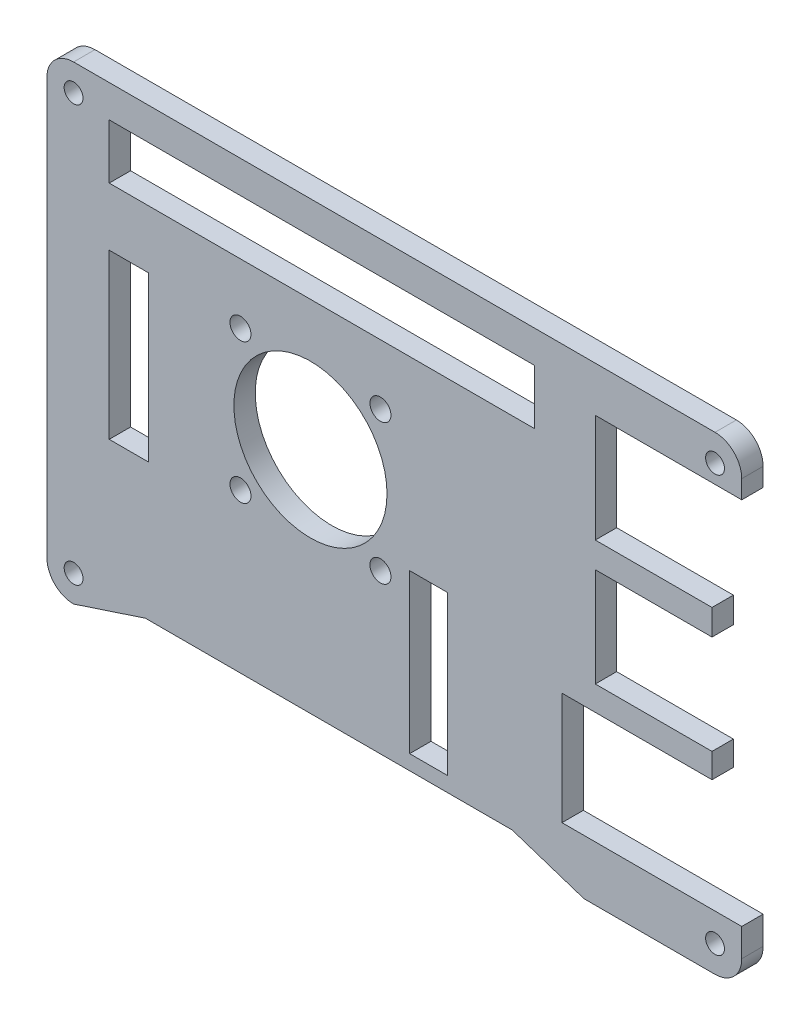
from build123d import *

# Parameters (mm, degrees)
SKETCH1_R           = 1.3462
SKETCH1_W           = 5.4034
SKETCH1_H           = 22.6066
SKETCH1_W_2         = 60.6932
SKETCH1_H_2         = 7.81
SKETCH1_W_3         = 5.588
SKETCH1_H_3         = 23.368
BOSS_EXTRUDE1_DEPTH = 3.048
SKETCH2_R           = 10.922
SKETCH2_R_2         = 1.4986
CUT_EXTRUDE1_DEPTH  = 72.310891511


with BuildPart() as part:
    # Sketch1 → Boss-Extrude1 (new body)
    with BuildSketch(Plane.XY):
        with BuildLine():
            Line((57.404932375, 30.507694304), (-34.084892625, 30.507694304))
            ThreePointArc((-34.084892625, 30.507694304), (-36.778969461, 29.391771141), (-37.894892625, 26.697694304))
            Line((-37.894892625, 26.697694304), (-37.894892625, -32.641005696))
            ThreePointArc((-37.894892625, -32.641005696), (-36.778969461, -35.335082532), (-34.084892625, -36.451005696))
            Line((-34.084892625, -36.451005696), (-23.844892625, -33.084405696))
            Line((-23.844892625, -33.084405696), (28.474307375, -33.084405696))
            Line((28.474307375, -33.084405696), (38.714307375, -36.451005696))
            Line((38.714307375, -36.451005696), (57.405007375, -36.451005696))
            ThreePointArc((57.405007375, -36.451005696), (60.108826144, -35.325305244), (61.214907375, -32.613401529))
            Line((61.214907375, -32.613401529), (61.214907375, -28.627805696))
            Line((61.214907375, -28.627805696), (35.575007375, -28.627805696))
            Line((35.575007375, -28.627805696), (35.575007375, -12.628005696))
            Line((35.575007375, -12.628005696), (56.975007375, -12.628005696))
            Line((56.975007375, -12.628005696), (56.975007375, -9.121805696))
            Line((56.975007375, -9.121805696), (40.325007375, -9.121805696))
            Line((40.325007375, -9.121805696), (40.325007375, 4.997894304))
            Line((40.325007375, 4.997894304), (56.975007375, 4.997894304))
            Line((56.975007375, 4.997894304), (56.975007375, 8.658194304))
            Line((56.975007375, 8.658194304), (40.325007375, 8.658194304))
            Line((40.325007375, 8.658194304), (40.325007375, 24.068294304))
            Line((40.325007375, 24.068294304), (61.214907375, 24.068294304))
            Line((61.214907375, 24.068294304), (61.214907375, 26.683892153))
            ThreePointArc((61.214907375, 26.683892153), (60.103884597, 29.386886916), (57.404932375, 30.507694304))
        make_face()
        with Locations(Location((57.405007375, -32.641005696, 0), (0, 0, 180))):
            Circle(SKETCH1_R, mode=Mode.SUBTRACT)
        with Locations(Location((-34.084892625, -32.641005696, 0), (0, 0, 180))):
            Circle(SKETCH1_R, mode=Mode.SUBTRACT)
        with Locations(Location((-34.084892625, 26.697694304, 0), (0, 0, 180))):
            Circle(SKETCH1_R, mode=Mode.SUBTRACT)
        with Locations(Location((57.404932375, 26.697694304, 0), (0, 0, 180))):
            Circle(SKETCH1_R, mode=Mode.SUBTRACT)
        with Locations((16.546707375, -19.663505696)):
            Rectangle(SKETCH1_W, SKETCH1_H, mode=Mode.SUBTRACT)
        with Locations((1.341707375, 21.991994304)):
            Rectangle(SKETCH1_W_2, SKETCH1_H_2, mode=Mode.SUBTRACT)
        with Locations((-26.210892625, -1.882805696)):
            Rectangle(SKETCH1_W_3, SKETCH1_H_3, mode=Mode.SUBTRACT)
    extrude(amount=BOSS_EXTRUDE1_DEPTH)

    # Sketch2 → Cut-Extrude1 (cut, through all)
    with BuildSketch(Plane.XY.offset(3.048)):
        with Locations((-0.302892625, -0.480305696)):
            Circle(SKETCH2_R)
        with Locations((-10.285092625, -10.462505696)):
            Circle(SKETCH2_R_2)
        with Locations((-10.285092625, 9.501894304)):
            Circle(SKETCH2_R_2)
        with Locations((9.679307375, -10.462505696)):
            Circle(SKETCH2_R_2)
        with Locations((9.679307375, 9.501894304)):
            Circle(SKETCH2_R_2)
    extrude(amount=-CUT_EXTRUDE1_DEPTH, mode=Mode.SUBTRACT)


solid = part.part
